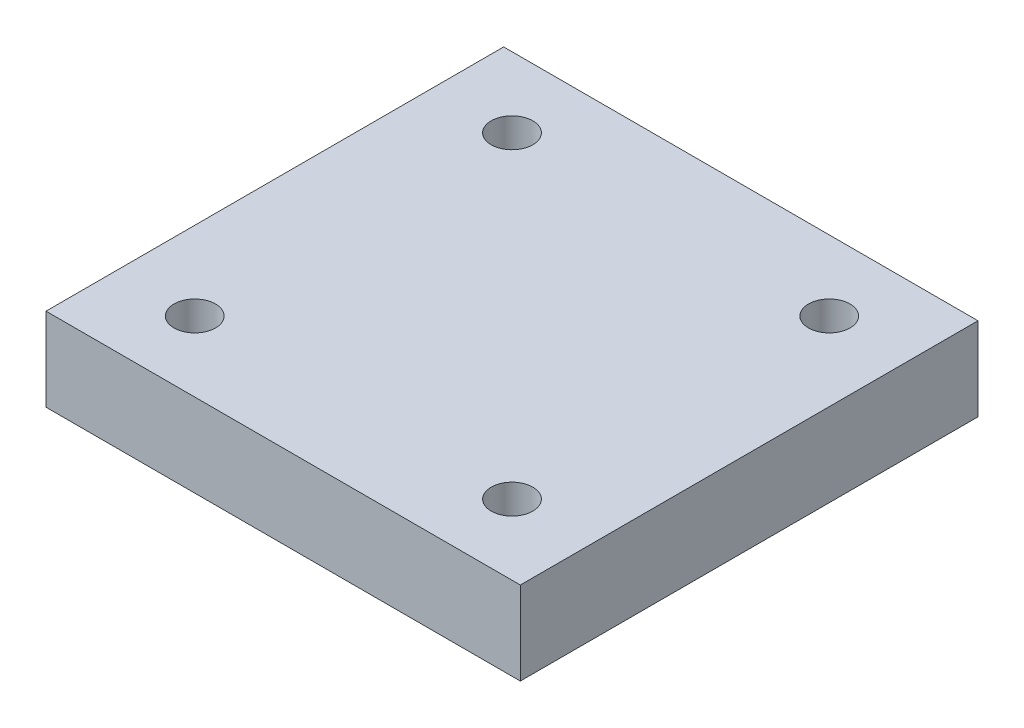
from build123d import *

# Parameters (mm, degrees)
SKETCH1_W           = 45.6
SKETCH1_H           = 44
SKETCH1_R           = 2
BOSS_EXTRUDE1_DEPTH = 8


with BuildPart() as part:
    # Sketch1 → Boss-Extrude1 (new body)
    with BuildSketch(Plane(origin=(0, 0, 0), x_dir=(1, 0, 0), z_dir=(0, 1, 0))):
        Rectangle(SKETCH1_W, SKETCH1_H)
        with Locations((15.25, 15.25)):
            Circle(SKETCH1_R, mode=Mode.SUBTRACT)
        with Locations((-15.25, -15.25)):
            Circle(SKETCH1_R, mode=Mode.SUBTRACT)
        with Locations((-15.25, 15.25)):
            Circle(SKETCH1_R, mode=Mode.SUBTRACT)
        with Locations((15.25, -15.25)):
            Circle(SKETCH1_R, mode=Mode.SUBTRACT)
    extrude(amount=BOSS_EXTRUDE1_DEPTH)


solid = part.part
